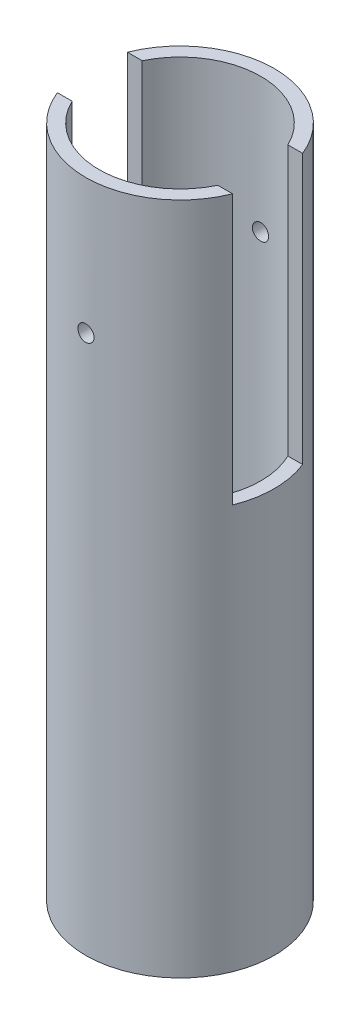
from build123d import *

# Parameters (mm, degrees)
ESQUISSE3_R                  = 35
ESQUISSE3_R_2                = 30
BOSS_EXTRU_3_DEPTH           = 250
ESQUISSE4_W                  = 124.19
ESQUISSE4_H                  = 26
ENL_V_MAT_EXTRU_1_DEPTH      = 100
ENL_V_MAT_EXTRU_2_DEPTH      = 100
ENL_V_MAT_EXTRU_2_DEPTH_BACK = 100
ESQUISSE6_R                  = 3


with BuildPart() as part:
    # Esquisse3 → Boss.-Extru.3 (new body)
    with BuildSketch(Plane(origin=(0, 0, 0), x_dir=(1, 0, 0), z_dir=(0, 1, 0))):
        with Locations(Location((0, 0, 0), (0, 0, 270))):
            Circle(ESQUISSE3_R)
        with Locations(Location((0, 0, 0), (0, 0, 270))):
            Circle(ESQUISSE3_R_2, mode=Mode.SUBTRACT)
    extrude(amount=BOSS_EXTRU_3_DEPTH)

    # Esquisse4 → Enlèv. mat.-Extru.1 (cut)
    with BuildSketch(Plane(origin=(0, 250, 0), x_dir=(1, 0, 0), z_dir=(0, 1, 0))):
        Rectangle(ESQUISSE4_W, ESQUISSE4_H)
    extrude(amount=-ENL_V_MAT_EXTRU_1_DEPTH, mode=Mode.SUBTRACT)

    # Esquisse6 → Enlèv. mat.-Extru.2 (cut, two sides: drawn at the far end of the back side and taken through both)
    with BuildSketch(Plane.XY.offset(-ENL_V_MAT_EXTRU_2_DEPTH_BACK)):
        with Locations(Location((0, 200, 0), (0, 0, 180))):
            Circle(ESQUISSE6_R)
    extrude(amount=ENL_V_MAT_EXTRU_2_DEPTH + ENL_V_MAT_EXTRU_2_DEPTH_BACK, mode=Mode.SUBTRACT)


solid = part.part
